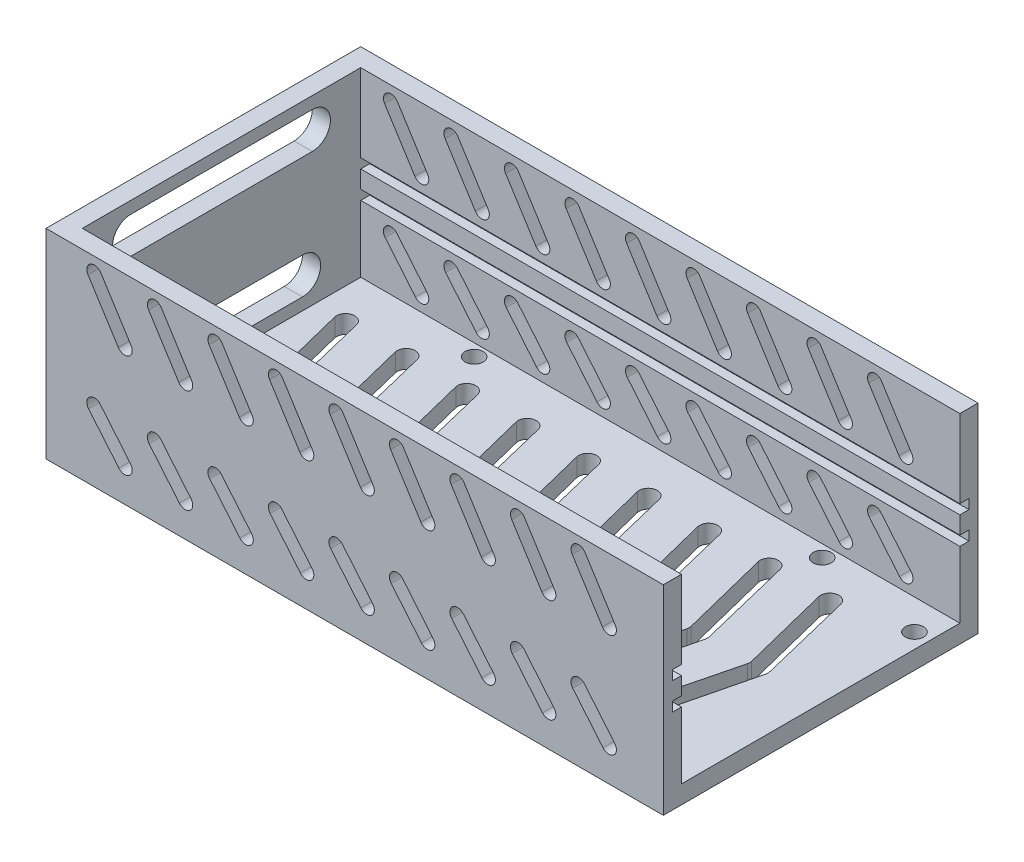
from build123d import *

# Parameters (mm, degrees)
SKETCH1_W           = 99
SKETCH1_H           = 52
SKETCH1_R           = 1.5
BOSS_EXTRUDE1_DEPTH = 33
SKETCH2_W           = 99
SKETCH2_H           = 46
CUT_EXTRUDE1_DEPTH  = 30
SKETCH3_W           = 1.5
SKETCH3_H           = 1.6
CUT_EXTRUDE2_DEPTH  = 99
SKETCH4_W           = 3
SKETCH4_H           = 52
BOSS_EXTRUDE2_DEPTH = 33
CUT_EXTRUDE3_DEPTH  = 3
CUT_EXTRUDE4_DEPTH  = 3
CUT_EXTRUDE5_START  = -52
CUT_EXTRUDE5_DEPTH  = 52
CUT_EXTRUDE6_DEPTH  = 3
SKETCH10_R          = 1.5
CUT_EXTRUDE7_DEPTH  = 3


with BuildPart() as part:
    # Sketch1 → Boss-Extrude1 (new body)
    with BuildSketch(Plane(origin=(0, 0, 0), x_dir=(1, 0, 0), z_dir=(0, 1, 0))):
        Rectangle(SKETCH1_W, SKETCH1_H)
        with Locations(Location((28.75, 21, 0), (0, 0, 270))):
            Circle(SKETCH1_R, mode=Mode.SUBTRACT)
        with Locations(Location((-28.75, 21, 0), (0, 0, 270))):
            Circle(SKETCH1_R, mode=Mode.SUBTRACT)
        with Locations(Location((25.25, -21, 0), (0, 0, 270))):
            Circle(SKETCH1_R, mode=Mode.SUBTRACT)
        with Locations(Location((-25.25, -21, 0), (0, 0, 270))):
            Circle(SKETCH1_R, mode=Mode.SUBTRACT)
    extrude(amount=BOSS_EXTRUDE1_DEPTH)

    # Sketch2 → Cut-Extrude1 (cut)
    with BuildSketch(Plane(origin=(0, 33, 0), x_dir=(1, 0, 0), z_dir=(0, 1, 0))):
        Rectangle(SKETCH2_W, SKETCH2_H)
    extrude(amount=-CUT_EXTRUDE1_DEPTH, mode=Mode.SUBTRACT)

    # Sketch3 → Cut-Extrude2 (cut)
    with BuildSketch(Plane(origin=(49.5, 0, 0), x_dir=(0, 0, -1), z_dir=(1, 0, 0))):
        with Locations((-23.75, 14.8)):
            Rectangle(SKETCH3_W, SKETCH3_H)
        with Locations((23.75, 14.8)):
            Rectangle(SKETCH3_W, SKETCH3_H)
        with Locations((-23.75, 19.3)):
            Rectangle(SKETCH3_W, SKETCH3_H)
        with Locations((23.75, 19.3)):
            Rectangle(SKETCH3_W, SKETCH3_H)
    extrude(amount=-CUT_EXTRUDE2_DEPTH, mode=Mode.SUBTRACT)

    # Sketch4 → Boss-Extrude2 (add)
    with BuildSketch(Plane(origin=(0, 0, 0), x_dir=(1, 0, 0), z_dir=(0, 1, 0))):
        with Locations((-51, 0)):
            Rectangle(SKETCH4_W, SKETCH4_H)
    extrude(amount=BOSS_EXTRUDE2_DEPTH)

    # Sketch5 → Cut-Extrude3 (cut)
    with BuildSketch(Plane(origin=(-49.5, 0, 0), x_dir=(0, 0, -1), z_dir=(1, 0, 0))):
        with BuildLine():
            Line((-15, 31), (15, 31))
            ThreePointArc((15, 31), (18, 28), (15, 25))
            Line((15, 25), (-15, 25))
            ThreePointArc((-15, 25), (-18, 28), (-15, 31))
        make_face()
        with BuildLine():
            Line((-13.375235204, 11), (13.375235204, 11))
            ThreePointArc((13.375235204, 11), (16.375235204, 8), (13.375235204, 5))
            Line((13.375235204, 5), (-13.375235204, 5))
            ThreePointArc((-13.375235204, 5), (-16.375235204, 8), (-13.375235204, 11))
        make_face()
    extrude(amount=-CUT_EXTRUDE3_DEPTH, mode=Mode.SUBTRACT)

    # Sketch6 → Cut-Extrude4 (cut)
    with BuildSketch(Plane.XY.offset(-23)):
        with BuildLine():
            Line((-45.556225247, 29.831503008), (-40.556225247, 21.931503008))
            ThreePointArc((-40.556225247, 21.931503008), (-38.831503008, 21.543774753), (-38.443774753, 23.268496992))
            Line((-38.443774753, 23.268496992), (-43.443774753, 31.168496992))
            ThreePointArc((-43.443774753, 31.168496992), (-45.168496992, 31.556225247), (-45.556225247, 29.831503008))
        make_face()
        with BuildLine():
            Line((-43.539723401, 12.3002305), (-38.539723401, 6.3002305))
            ThreePointArc((-38.539723401, 6.3002305), (-38.6997695, 4.539723401), (-40.460276599, 4.6997695))
            Line((-40.460276599, 4.6997695), (-45.460276599, 10.6997695))
            ThreePointArc((-45.460276599, 10.6997695), (-45.3002305, 12.460276599), (-43.539723401, 12.3002305))
        make_face()
        with BuildLine():
            Line((-35.556225247, 29.831503008), (-30.556225247, 21.931503008))
            ThreePointArc((-30.556225247, 21.931503008), (-28.831503008, 21.543774753), (-28.443774753, 23.268496992))
            Line((-28.443774753, 23.268496992), (-33.443774753, 31.168496992))
            ThreePointArc((-33.443774753, 31.168496992), (-35.168496992, 31.556225247), (-35.556225247, 29.831503008))
        make_face()
        with BuildLine():
            Line((-33.539723401, 12.3002305), (-28.539723401, 6.3002305))
            ThreePointArc((-28.539723401, 6.3002305), (-28.6997695, 4.539723401), (-30.460276599, 4.6997695))
            Line((-30.460276599, 4.6997695), (-35.460276599, 10.6997695))
            ThreePointArc((-35.460276599, 10.6997695), (-35.3002305, 12.460276599), (-33.539723401, 12.3002305))
        make_face()
        with BuildLine():
            Line((-25.556225247, 29.831503008), (-20.556225247, 21.931503008))
            ThreePointArc((-20.556225247, 21.931503008), (-18.831503008, 21.543774753), (-18.443774753, 23.268496992))
            Line((-18.443774753, 23.268496992), (-23.443774753, 31.168496992))
            ThreePointArc((-23.443774753, 31.168496992), (-25.168496992, 31.556225247), (-25.556225247, 29.831503008))
        make_face()
        with BuildLine():
            Line((-23.539723401, 12.3002305), (-18.539723401, 6.3002305))
            ThreePointArc((-18.539723401, 6.3002305), (-18.6997695, 4.539723401), (-20.460276599, 4.6997695))
            Line((-20.460276599, 4.6997695), (-25.460276599, 10.6997695))
            ThreePointArc((-25.460276599, 10.6997695), (-25.3002305, 12.460276599), (-23.539723401, 12.3002305))
        make_face()
        with BuildLine():
            Line((-15.556225247, 29.831503008), (-10.556225247, 21.931503008))
            ThreePointArc((-10.556225247, 21.931503008), (-8.831503008, 21.543774753), (-8.443774753, 23.268496992))
            Line((-8.443774753, 23.268496992), (-13.443774753, 31.168496992))
            ThreePointArc((-13.443774753, 31.168496992), (-15.168496992, 31.556225247), (-15.556225247, 29.831503008))
        make_face()
        with BuildLine():
            Line((-13.539723401, 12.3002305), (-8.539723401, 6.3002305))
            ThreePointArc((-8.539723401, 6.3002305), (-8.6997695, 4.539723401), (-10.460276599, 4.6997695))
            Line((-10.460276599, 4.6997695), (-15.460276599, 10.6997695))
            ThreePointArc((-15.460276599, 10.6997695), (-15.3002305, 12.460276599), (-13.539723401, 12.3002305))
        make_face()
        with BuildLine():
            Line((-5.556225247, 29.831503008), (-0.556225247, 21.931503008))
            ThreePointArc((-0.556225247, 21.931503008), (1.168496992, 21.543774753), (1.556225247, 23.268496992))
            Line((1.556225247, 23.268496992), (-3.443774753, 31.168496992))
            ThreePointArc((-3.443774753, 31.168496992), (-5.168496992, 31.556225247), (-5.556225247, 29.831503008))
        make_face()
        with BuildLine():
            Line((-3.539723401, 12.3002305), (1.460276599, 6.3002305))
            ThreePointArc((1.460276599, 6.3002305), (1.3002305, 4.539723401), (-0.460276599, 4.6997695))
            Line((-0.460276599, 4.6997695), (-5.460276599, 10.6997695))
            ThreePointArc((-5.460276599, 10.6997695), (-5.3002305, 12.460276599), (-3.539723401, 12.3002305))
        make_face()
        with BuildLine():
            Line((4.443774753, 29.831503008), (9.443774753, 21.931503008))
            ThreePointArc((9.443774753, 21.931503008), (11.168496992, 21.543774753), (11.556225247, 23.268496992))
            Line((11.556225247, 23.268496992), (6.556225247, 31.168496992))
            ThreePointArc((6.556225247, 31.168496992), (4.831503008, 31.556225247), (4.443774753, 29.831503008))
        make_face()
        with BuildLine():
            Line((6.460276599, 12.3002305), (11.460276599, 6.3002305))
            ThreePointArc((11.460276599, 6.3002305), (11.3002305, 4.539723401), (9.539723401, 4.6997695))
            Line((9.539723401, 4.6997695), (4.539723401, 10.6997695))
            ThreePointArc((4.539723401, 10.6997695), (4.6997695, 12.460276599), (6.460276599, 12.3002305))
        make_face()
        with BuildLine():
            Line((14.443774753, 29.831503008), (19.443774753, 21.931503008))
            ThreePointArc((19.443774753, 21.931503008), (21.168496992, 21.543774753), (21.556225247, 23.268496992))
            Line((21.556225247, 23.268496992), (16.556225247, 31.168496992))
            ThreePointArc((16.556225247, 31.168496992), (14.831503008, 31.556225247), (14.443774753, 29.831503008))
        make_face()
        with BuildLine():
            Line((16.460276599, 12.3002305), (21.460276599, 6.3002305))
            ThreePointArc((21.460276599, 6.3002305), (21.3002305, 4.539723401), (19.539723401, 4.6997695))
            Line((19.539723401, 4.6997695), (14.539723401, 10.6997695))
            ThreePointArc((14.539723401, 10.6997695), (14.6997695, 12.460276599), (16.460276599, 12.3002305))
        make_face()
        with BuildLine():
            Line((24.443774753, 29.831503008), (29.443774753, 21.931503008))
            ThreePointArc((29.443774753, 21.931503008), (31.168496992, 21.543774753), (31.556225247, 23.268496992))
            Line((31.556225247, 23.268496992), (26.556225247, 31.168496992))
            ThreePointArc((26.556225247, 31.168496992), (24.831503008, 31.556225247), (24.443774753, 29.831503008))
        make_face()
        with BuildLine():
            Line((26.460276599, 12.3002305), (31.460276599, 6.3002305))
            ThreePointArc((31.460276599, 6.3002305), (31.3002305, 4.539723401), (29.539723401, 4.6997695))
            Line((29.539723401, 4.6997695), (24.539723401, 10.6997695))
            ThreePointArc((24.539723401, 10.6997695), (24.6997695, 12.460276599), (26.460276599, 12.3002305))
        make_face()
        with BuildLine():
            Line((34.443774753, 29.831503008), (39.443774753, 21.931503008))
            ThreePointArc((39.443774753, 21.931503008), (41.168496992, 21.543774753), (41.556225247, 23.268496992))
            Line((41.556225247, 23.268496992), (36.556225247, 31.168496992))
            ThreePointArc((36.556225247, 31.168496992), (34.831503008, 31.556225247), (34.443774753, 29.831503008))
        make_face()
        with BuildLine():
            Line((36.460276599, 12.3002305), (41.460276599, 6.3002305))
            ThreePointArc((41.460276599, 6.3002305), (41.3002305, 4.539723401), (39.539723401, 4.6997695))
            Line((39.539723401, 4.6997695), (34.539723401, 10.6997695))
            ThreePointArc((34.539723401, 10.6997695), (34.6997695, 12.460276599), (36.460276599, 12.3002305))
        make_face()
    extrude(amount=-CUT_EXTRUDE4_DEPTH, mode=Mode.SUBTRACT)

    # Sketch7 → Cut-Extrude5 (cut)
    with BuildSketch(Plane(origin=(0, 0, -26), x_dir=(-1, 0, 0), z_dir=(0, 0, -1)).offset(CUT_EXTRUDE5_START)):
        with BuildLine():
            Line((40.556225247, 21.931503008), (45.556225247, 29.831503008))
            ThreePointArc((45.556225247, 29.831503008), (45.168496992, 31.556225247), (43.443774753, 31.168496992))
            Line((43.443774753, 31.168496992), (38.443774753, 23.268496992))
            ThreePointArc((38.443774753, 23.268496992), (38.831503008, 21.543774753), (40.556225247, 21.931503008))
        make_face()
        with BuildLine():
            Line((43.539723401, 12.3002305), (38.539723401, 6.3002305))
            ThreePointArc((38.539723401, 6.3002305), (38.6997695, 4.539723401), (40.460276599, 4.6997695))
            Line((40.460276599, 4.6997695), (45.460276599, 10.6997695))
            ThreePointArc((45.460276599, 10.6997695), (45.3002305, 12.460276599), (43.539723401, 12.3002305))
        make_face()
        with BuildLine():
            Line((30.556225247, 21.931503008), (35.556225247, 29.831503008))
            ThreePointArc((35.556225247, 29.831503008), (35.168496992, 31.556225247), (33.443774753, 31.168496992))
            Line((33.443774753, 31.168496992), (28.443774753, 23.268496992))
            ThreePointArc((28.443774753, 23.268496992), (28.831503008, 21.543774753), (30.556225247, 21.931503008))
        make_face()
        with BuildLine():
            Line((33.539723401, 12.3002305), (28.539723401, 6.3002305))
            ThreePointArc((28.539723401, 6.3002305), (28.6997695, 4.539723401), (30.460276599, 4.6997695))
            Line((30.460276599, 4.6997695), (35.460276599, 10.6997695))
            ThreePointArc((35.460276599, 10.6997695), (35.3002305, 12.460276599), (33.539723401, 12.3002305))
        make_face()
        with BuildLine():
            Line((20.556225247, 21.931503008), (25.556225247, 29.831503008))
            ThreePointArc((25.556225247, 29.831503008), (25.168496992, 31.556225247), (23.443774753, 31.168496992))
            Line((23.443774753, 31.168496992), (18.443774753, 23.268496992))
            ThreePointArc((18.443774753, 23.268496992), (18.831503008, 21.543774753), (20.556225247, 21.931503008))
        make_face()
        with BuildLine():
            Line((23.539723401, 12.3002305), (18.539723401, 6.3002305))
            ThreePointArc((18.539723401, 6.3002305), (18.6997695, 4.539723401), (20.460276599, 4.6997695))
            Line((20.460276599, 4.6997695), (25.460276599, 10.6997695))
            ThreePointArc((25.460276599, 10.6997695), (25.3002305, 12.460276599), (23.539723401, 12.3002305))
        make_face()
        with BuildLine():
            Line((10.556225247, 21.931503008), (15.556225247, 29.831503008))
            ThreePointArc((15.556225247, 29.831503008), (15.168496992, 31.556225247), (13.443774753, 31.168496992))
            Line((13.443774753, 31.168496992), (8.443774753, 23.268496992))
            ThreePointArc((8.443774753, 23.268496992), (8.831503008, 21.543774753), (10.556225247, 21.931503008))
        make_face()
        with BuildLine():
            Line((13.539723401, 12.3002305), (8.539723401, 6.3002305))
            ThreePointArc((8.539723401, 6.3002305), (8.6997695, 4.539723401), (10.460276599, 4.6997695))
            Line((10.460276599, 4.6997695), (15.460276599, 10.6997695))
            ThreePointArc((15.460276599, 10.6997695), (15.3002305, 12.460276599), (13.539723401, 12.3002305))
        make_face()
        with BuildLine():
            Line((0.556225247, 21.931503008), (5.556225247, 29.831503008))
            ThreePointArc((5.556225247, 29.831503008), (5.168496992, 31.556225247), (3.443774753, 31.168496992))
            Line((3.443774753, 31.168496992), (-1.556225247, 23.268496992))
            ThreePointArc((-1.556225247, 23.268496992), (-1.168496992, 21.543774753), (0.556225247, 21.931503008))
        make_face()
        with BuildLine():
            Line((3.539723401, 12.3002305), (-1.460276599, 6.3002305))
            ThreePointArc((-1.460276599, 6.3002305), (-1.3002305, 4.539723401), (0.460276599, 4.6997695))
            Line((0.460276599, 4.6997695), (5.460276599, 10.6997695))
            ThreePointArc((5.460276599, 10.6997695), (5.3002305, 12.460276599), (3.539723401, 12.3002305))
        make_face()
        with BuildLine():
            Line((-9.443774753, 21.931503008), (-4.443774753, 29.831503008))
            ThreePointArc((-4.443774753, 29.831503008), (-4.831503008, 31.556225247), (-6.556225247, 31.168496992))
            Line((-6.556225247, 31.168496992), (-11.556225247, 23.268496992))
            ThreePointArc((-11.556225247, 23.268496992), (-11.168496992, 21.543774753), (-9.443774753, 21.931503008))
        make_face()
        with BuildLine():
            Line((-6.460276599, 12.3002305), (-11.460276599, 6.3002305))
            ThreePointArc((-11.460276599, 6.3002305), (-11.3002305, 4.539723401), (-9.539723401, 4.6997695))
            Line((-9.539723401, 4.6997695), (-4.539723401, 10.6997695))
            ThreePointArc((-4.539723401, 10.6997695), (-4.6997695, 12.460276599), (-6.460276599, 12.3002305))
        make_face()
        with BuildLine():
            Line((-19.443774753, 21.931503008), (-14.443774753, 29.831503008))
            ThreePointArc((-14.443774753, 29.831503008), (-14.831503008, 31.556225247), (-16.556225247, 31.168496992))
            Line((-16.556225247, 31.168496992), (-21.556225247, 23.268496992))
            ThreePointArc((-21.556225247, 23.268496992), (-21.168496992, 21.543774753), (-19.443774753, 21.931503008))
        make_face()
        with BuildLine():
            Line((-16.460276599, 12.3002305), (-21.460276599, 6.3002305))
            ThreePointArc((-21.460276599, 6.3002305), (-21.3002305, 4.539723401), (-19.539723401, 4.6997695))
            Line((-19.539723401, 4.6997695), (-14.539723401, 10.6997695))
            ThreePointArc((-14.539723401, 10.6997695), (-14.6997695, 12.460276599), (-16.460276599, 12.3002305))
        make_face()
        with BuildLine():
            Line((-29.443774753, 21.931503008), (-24.443774753, 29.831503008))
            ThreePointArc((-24.443774753, 29.831503008), (-24.831503008, 31.556225247), (-26.556225247, 31.168496992))
            Line((-26.556225247, 31.168496992), (-31.556225247, 23.268496992))
            ThreePointArc((-31.556225247, 23.268496992), (-31.168496992, 21.543774753), (-29.443774753, 21.931503008))
        make_face()
        with BuildLine():
            Line((-26.460276599, 12.3002305), (-31.460276599, 6.3002305))
            ThreePointArc((-31.460276599, 6.3002305), (-31.3002305, 4.539723401), (-29.539723401, 4.6997695))
            Line((-29.539723401, 4.6997695), (-24.539723401, 10.6997695))
            ThreePointArc((-24.539723401, 10.6997695), (-24.6997695, 12.460276599), (-26.460276599, 12.3002305))
        make_face()
        with BuildLine():
            Line((-39.443774753, 21.931503008), (-34.443774753, 29.831503008))
            ThreePointArc((-34.443774753, 29.831503008), (-34.831503008, 31.556225247), (-36.556225247, 31.168496992))
            Line((-36.556225247, 31.168496992), (-41.556225247, 23.268496992))
            ThreePointArc((-41.556225247, 23.268496992), (-41.168496992, 21.543774753), (-39.443774753, 21.931503008))
        make_face()
        with BuildLine():
            Line((-36.460276599, 12.3002305), (-41.460276599, 6.3002305))
            ThreePointArc((-41.460276599, 6.3002305), (-41.3002305, 4.539723401), (-39.539723401, 4.6997695))
            Line((-39.539723401, 4.6997695), (-34.539723401, 10.6997695))
            ThreePointArc((-34.539723401, 10.6997695), (-34.6997695, 12.460276599), (-36.460276599, 12.3002305))
        make_face()
    extrude(amount=CUT_EXTRUDE5_DEPTH, mode=Mode.SUBTRACT)

    # Sketch8 → Cut-Extrude6 (cut)
    with BuildSketch(Plane(origin=(0, 3, 0), x_dir=(1, 0, 0), z_dir=(0, 1, 0))):
        with BuildLine():
            Line((-42.257817718, 0.355834591), (-45.967898191, 15.191333674))
            ThreePointArc((-45.967898191, 15.191333674), (-44.832293654, 16.962730641), (-43.042817189, 15.855834591))
            Line((-43.042817189, 15.855834591), (-39.257817718, 0.355834591))
            ThreePointArc((-39.257817718, 0.355834591), (-39.215000529, 0), (-39.257817718, -0.355834591))
            Line((-39.257817718, -0.355834591), (-43.042817189, -15.855834591))
            ThreePointArc((-43.042817189, -15.855834591), (-44.834861155, -16.962145002), (-45.966805336, -15.186181414))
            Line((-45.966805336, -15.186181414), (-42.257817718, -0.355834591))
            ThreePointArc((-42.257817718, -0.355834591), (-42.215000529, 0), (-42.257817718, 0.355834591))
        make_face()
        with BuildLine():
            Line((-32.257817718, 0.355834591), (-35.967898191, 15.191333674))
            ThreePointArc((-35.967898191, 15.191333674), (-34.832293654, 16.962730641), (-33.042817189, 15.855834591))
            Line((-33.042817189, 15.855834591), (-29.257817718, 0.355834591))
            ThreePointArc((-29.257817718, 0.355834591), (-29.215000529, 0), (-29.257817718, -0.355834591))
            Line((-29.257817718, -0.355834591), (-33.042817189, -15.855834591))
            ThreePointArc((-33.042817189, -15.855834591), (-34.834861155, -16.962145002), (-35.966805336, -15.186181414))
            Line((-35.966805336, -15.186181414), (-32.257817718, -0.355834591))
            ThreePointArc((-32.257817718, -0.355834591), (-32.215000529, 0), (-32.257817718, 0.355834591))
        make_face()
        with BuildLine():
            Line((-22.257817718, 0.355834591), (-25.967898191, 15.191333674))
            ThreePointArc((-25.967898191, 15.191333674), (-24.832293654, 16.962730641), (-23.042817189, 15.855834591))
            Line((-23.042817189, 15.855834591), (-19.257817718, 0.355834591))
            ThreePointArc((-19.257817718, 0.355834591), (-19.215000529, 0), (-19.257817718, -0.355834591))
            Line((-19.257817718, -0.355834591), (-23.042817189, -15.855834591))
            ThreePointArc((-23.042817189, -15.855834591), (-24.834861155, -16.962145002), (-25.966805336, -15.186181414))
            Line((-25.966805336, -15.186181414), (-22.257817718, -0.355834591))
            ThreePointArc((-22.257817718, -0.355834591), (-22.215000529, 0), (-22.257817718, 0.355834591))
        make_face()
        with BuildLine():
            Line((-12.257817718, 0.355834591), (-15.967898191, 15.191333674))
            ThreePointArc((-15.967898191, 15.191333674), (-14.832293654, 16.962730641), (-13.042817189, 15.855834591))
            Line((-13.042817189, 15.855834591), (-9.257817718, 0.355834591))
            ThreePointArc((-9.257817718, 0.355834591), (-9.215000529, 0), (-9.257817718, -0.355834591))
            Line((-9.257817718, -0.355834591), (-13.042817189, -15.855834591))
            ThreePointArc((-13.042817189, -15.855834591), (-14.834861155, -16.962145002), (-15.966805336, -15.186181414))
            Line((-15.966805336, -15.186181414), (-12.257817718, -0.355834591))
            ThreePointArc((-12.257817718, -0.355834591), (-12.215000529, 0), (-12.257817718, 0.355834591))
        make_face()
        with BuildLine():
            Line((-2.257817718, 0.355834591), (-5.967898191, 15.191333674))
            ThreePointArc((-5.967898191, 15.191333674), (-4.832293654, 16.962730641), (-3.042817189, 15.855834591))
            Line((-3.042817189, 15.855834591), (0.742182282, 0.355834591))
            ThreePointArc((0.742182282, 0.355834591), (0.784999471, 0), (0.742182282, -0.355834591))
            Line((0.742182282, -0.355834591), (-3.042817189, -15.855834591))
            ThreePointArc((-3.042817189, -15.855834591), (-4.834861155, -16.962145002), (-5.966805336, -15.186181414))
            Line((-5.966805336, -15.186181414), (-2.257817718, -0.355834591))
            ThreePointArc((-2.257817718, -0.355834591), (-2.215000529, 0), (-2.257817718, 0.355834591))
        make_face()
        with BuildLine():
            Line((7.742182282, 0.355834591), (4.032101809, 15.191333674))
            ThreePointArc((4.032101809, 15.191333674), (5.167706346, 16.962730641), (6.957182811, 15.855834591))
            Line((6.957182811, 15.855834591), (10.742182282, 0.355834591))
            ThreePointArc((10.742182282, 0.355834591), (10.784999471, 0), (10.742182282, -0.355834591))
            Line((10.742182282, -0.355834591), (6.957182811, -15.855834591))
            ThreePointArc((6.957182811, -15.855834591), (5.165138845, -16.962145002), (4.033194664, -15.186181414))
            Line((4.033194664, -15.186181414), (7.742182282, -0.355834591))
            ThreePointArc((7.742182282, -0.355834591), (7.784999471, 0), (7.742182282, 0.355834591))
        make_face()
        with BuildLine():
            Line((17.742182282, 0.355834591), (14.032101809, 15.191333674))
            ThreePointArc((14.032101809, 15.191333674), (15.167706346, 16.962730641), (16.957182811, 15.855834591))
            Line((16.957182811, 15.855834591), (20.742182282, 0.355834591))
            ThreePointArc((20.742182282, 0.355834591), (20.784999471, 0), (20.742182282, -0.355834591))
            Line((20.742182282, -0.355834591), (16.957182811, -15.855834591))
            ThreePointArc((16.957182811, -15.855834591), (15.165138845, -16.962145002), (14.033194664, -15.186181414))
            Line((14.033194664, -15.186181414), (17.742182282, -0.355834591))
            ThreePointArc((17.742182282, -0.355834591), (17.784999471, 0), (17.742182282, 0.355834591))
        make_face()
        with BuildLine():
            Line((27.742182282, 0.355834591), (24.032101809, 15.191333674))
            ThreePointArc((24.032101809, 15.191333674), (25.167706346, 16.962730641), (26.957182811, 15.855834591))
            Line((26.957182811, 15.855834591), (30.742182282, 0.355834591))
            ThreePointArc((30.742182282, 0.355834591), (30.784999471, 0), (30.742182282, -0.355834591))
            Line((30.742182282, -0.355834591), (26.957182811, -15.855834591))
            ThreePointArc((26.957182811, -15.855834591), (25.165138845, -16.962145002), (24.033194664, -15.186181414))
            Line((24.033194664, -15.186181414), (27.742182282, -0.355834591))
            ThreePointArc((27.742182282, -0.355834591), (27.784999471, 0), (27.742182282, 0.355834591))
        make_face()
        with BuildLine():
            Line((37.742182282, 0.355834591), (34.032101809, 15.191333674))
            ThreePointArc((34.032101809, 15.191333674), (35.167706346, 16.962730641), (36.957182811, 15.855834591))
            Line((36.957182811, 15.855834591), (40.742182282, 0.355834591))
            ThreePointArc((40.742182282, 0.355834591), (40.784999471, 0), (40.742182282, -0.355834591))
            Line((40.742182282, -0.355834591), (36.957182811, -15.855834591))
            ThreePointArc((36.957182811, -15.855834591), (35.165138845, -16.962145002), (34.033194664, -15.186181414))
            Line((34.033194664, -15.186181414), (37.742182282, -0.355834591))
            ThreePointArc((37.742182282, -0.355834591), (37.784999471, 0), (37.742182282, 0.355834591))
        make_face()
    extrude(amount=-CUT_EXTRUDE6_DEPTH, mode=Mode.SUBTRACT)

    # Sketch10 → Cut-Extrude7 (cut)
    with BuildSketch(Plane(origin=(0, 3, 0), x_dir=(1, 0, 0), z_dir=(0, 1, 0))):
        with Locations(Location((47, 18, 0), (0, 0, 270))):
            Circle(SKETCH10_R)
    extrude(amount=-CUT_EXTRUDE7_DEPTH, mode=Mode.SUBTRACT)


solid = part.part
